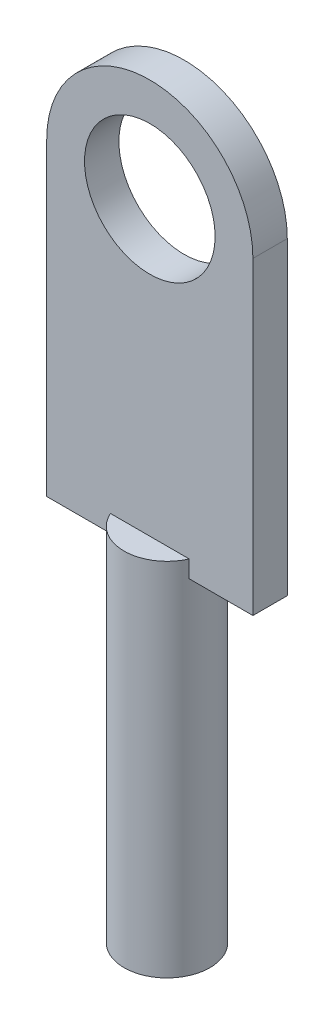
from build123d import *

# Parameters (mm, degrees)
SKETCH1_R      = 1.5875
EXTRUDE1_DEPTH = 8.255
SKETCH2_R      = 2.413
EXTRUDE2_DEPTH = 0.635
EXTRUDE3_START = 5.08
SKETCH3_R      = 1.5875
EXTRUDE3_DEPTH = 5.08


with BuildPart() as part:
    # Sketch1 → Extrude1 (new body)
    with BuildSketch(Plane(origin=(0, 0, 0), x_dir=(1, 0, 0), z_dir=(0, 1, 0))):
        with Locations(Location((0, 0, 0), (0, 0, 270))):
            Circle(SKETCH1_R)
    extrude(amount=EXTRUDE1_DEPTH)

    # Sketch2 → Extrude2 (add, symmetric)
    with BuildSketch(Plane.XY):
        with BuildLine():
            Line((-3.81, 19.05), (-3.81, 7.62))
            Line((-3.81, 7.62), (3.81, 7.62))
            Line((3.81, 7.62), (3.81, 19.05))
            ThreePointArc((3.81, 19.05), (0, 22.86), (-3.81, 19.05))
        make_face()
        with Locations((0, 19.05)):
            Circle(SKETCH2_R, mode=Mode.SUBTRACT)
    extrude(amount=EXTRUDE2_DEPTH, both=True)

    # Sketch3 → Extrude3 (add)
    with BuildSketch(Plane.XZ.offset(EXTRUDE3_START)):
        with Locations(Location((0, 0, 0), (0, 0, 270))):
            Circle(SKETCH3_R)
    extrude(amount=-EXTRUDE3_DEPTH)


solid = part.part
